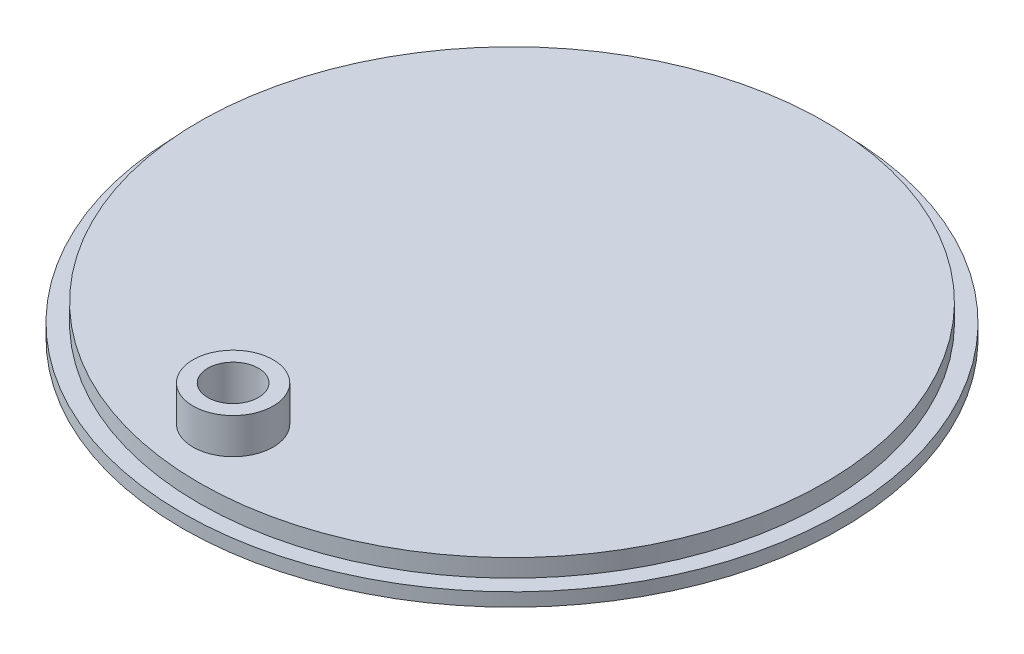
from build123d import *

# Parameters (mm, degrees)
SKETCH1_R           = 70.25
BOSS_EXTRUDE1_DEPTH = 4
SKETCH3_R           = 74
BOSS_EXTRUDE2_DEPTH = 3
SKETCH2_R           = 9
BOSS_EXTRUDE3_DEPTH = 8
SKETCH6_R           = 7
CUT_EXTRUDE2_DEPTH  = 3.5
SKETCH4_R           = 5.7
CUT_EXTRUDE3_DEPTH  = 106.721331812


with BuildPart() as part:
    # Sketch1 → Boss-Extrude1 (new body)
    with BuildSketch(Plane(origin=(0, 0, 0), x_dir=(1, 0, 0), z_dir=(0, 1, 0))):
        with Locations(Location((0, 0, 0), (0, 0, 270))):
            Circle(SKETCH1_R)
    extrude(amount=BOSS_EXTRUDE1_DEPTH)

    # Sketch3 → Boss-Extrude2 (add)
    with BuildSketch(Plane.XZ):
        with Locations(Location((0, 0, 0), (0, 0, 270))):
            Circle(SKETCH3_R)
    extrude(amount=BOSS_EXTRUDE2_DEPTH)

    # Sketch2 → Boss-Extrude3 (add)
    with BuildSketch(Plane(origin=(0, 4, 0), x_dir=(1, 0, 0), z_dir=(0, 1, 0))):
        with Locations(Location((-7.625001084, -55, 0), (0, 0, 270))):
            Circle(SKETCH2_R)
    extrude(amount=BOSS_EXTRUDE3_DEPTH)

    # Sketch6 → Cut-Extrude2 (cut)
    with BuildSketch(Plane.XZ.offset(3)):
        with Locations(Location((-7.625001084, 55, 0), (0, 0, 270))):
            Circle(SKETCH6_R)
    extrude(amount=-CUT_EXTRUDE2_DEPTH, mode=Mode.SUBTRACT)

    # Sketch4 → Cut-Extrude3 (cut, through all)
    with BuildSketch(Plane(origin=(0, 12, 0), x_dir=(1, 0, 0), z_dir=(0, 1, 0))):
        with Locations(Location((-7.625001084, -55, 0), (0, 0, 270))):
            Circle(SKETCH4_R)
    extrude(amount=-CUT_EXTRUDE3_DEPTH, mode=Mode.SUBTRACT)


solid = part.part
